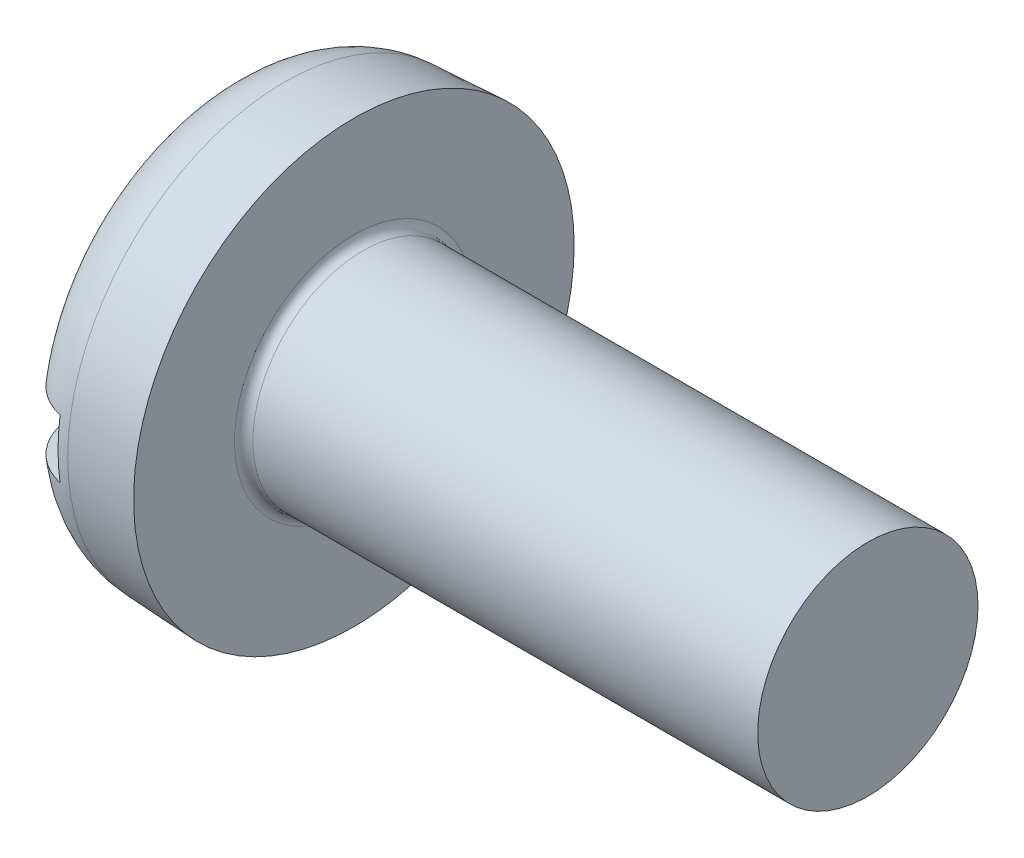
from build123d import *

# Parameters (mm, degrees)
SKETCH1_R        = 6
BASEHEAD_DEPTH   = 3.6
BASEHEAD_DRAFT   = -3
SKETCH2_R        = 3
BASEBODY_DEPTH   = 14
HEADFILLET2_R    = 1.8
NOTCH_DEPTH      = 19.96325394
NOTCH_DEPTH_BACK = 19.96325394
SKETCH3_W        = 1.6
SKETCH3_H        = 1.4
HEADFILLET1_R    = 0.25


with BuildPart() as part:
    # Sketch1 → BaseHead (with draft: the straight prism first)
    with BuildSketch(Plane(origin=(3.6, 0, 0), x_dir=(0, 0, -1), z_dir=(1, 0, 0))):
        Circle(SKETCH1_R)
    extrude(amount=-BASEHEAD_DEPTH)
    # BaseHead: the draft: its side faces are tilted about the plane it starts from
    basehead_sides = [part.faces().sort_by_distance(p)[0] for p in [
        (1.8, 0, 6),
    ]]
    draft(basehead_sides, Plane(origin=(3.6, 0, 0), x_dir=(0, 0, -1), z_dir=(1, 0, 0)), BASEHEAD_DRAFT)

    # Sketch2 → BaseBody (add)
    with BuildSketch(Plane(origin=(3.6, 0, 0), x_dir=(0, 0, -1), z_dir=(1, 0, 0))):
        Circle(SKETCH2_R)
    extrude(amount=BASEBODY_DEPTH)

    # HeadFillet2
    headfillet2_edges = [part.edges().sort_by_distance(p)[0] for p in [
        (0, 0, 5.811331995),
    ]]
    fillet(headfillet2_edges, radius=HEADFILLET2_R)

    # Sketch3 → Notch (cut, two sides: drawn at the far end of the back side and taken through both)
    with BuildSketch(Plane(origin=(1.05, -1.05, 0), x_dir=(0, -1, 0), z_dir=(0, 0, 1)).offset(-NOTCH_DEPTH_BACK)):
        with Locations((-1.05, -0.35)):
            Rectangle(SKETCH3_W, SKETCH3_H)
    extrude(amount=NOTCH_DEPTH + NOTCH_DEPTH_BACK, mode=Mode.SUBTRACT)

    # HeadFillet1
    headfillet1_edges = [part.edges().sort_by_distance(p)[0] for p in [
        (3.6, 0, 3),
    ]]
    fillet(headfillet1_edges, radius=HEADFILLET1_R)


solid = part.part
